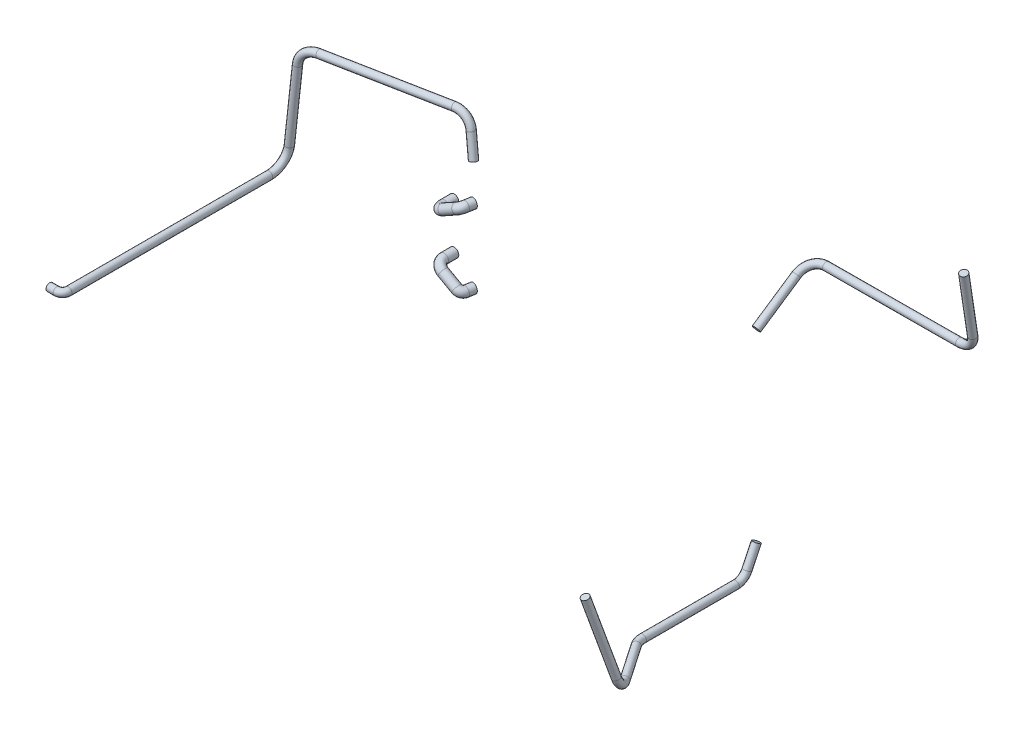
from build123d import *

# Parameters (mm, degrees)
PIPE_1_PROFILE_R = 5
PIPE_2_PROFILE_R = 5
PIPE_3_PROFILE_R = 4
PIPE_4_PROFILE_R = 4
PIPE_5_PROFILE_R = 4


with BuildPart() as part:
    # Pipe 1: sweep along a curve in space
    with BuildLine() as pipe_1_path:
        Line((300, 25, 337), (300, 25, 348))
        ThreePointArc((300, 25, 348), (302.304312645, 26.280173692, 354.363961031), (307.867415485, 29.370786381, 357))
        Line((307.867415485, 29.370786381, 357), (322.859191253, 37.699550696, 357))
        ThreePointArc((322.859191253, 37.699550696, 357), (326.042807371, 39.345053321, 355.669731643), (327.778744035, 40, 352.327535789))
        Line((327.778744035, 40, 352.327535789), (329, 40, 345))
    # Pipe 1 profile (on start of the path) → Pipe 1 (sweep)
    with BuildSketch(Plane(origin=(300, 25, 337), x_dir=(1, 0, 0), z_dir=(0, 0, 1))):
        Circle(PIPE_1_PROFILE_R)
    sweep(path=pipe_1_path.line)


with BuildPart() as body_2:
    # Pipe 2: sweep along a curve in space
    with BuildLine() as pipe_2_path:
        Line((300, -25, 337), (300, -25, 348))
        ThreePointArc((300, -25, 348), (302.304312645, -26.280173692, 354.363961031), (307.867415485, -29.370786381, 357))
        Line((307.867415485, -29.370786381, 357), (322.859191253, -37.699550696, 357))
        ThreePointArc((322.859191253, -37.699550696, 357), (326.042807371, -39.345053321, 355.669731643), (327.778744035, -40, 352.327535789))
        Line((327.778744035, -40, 352.327535789), (329, -40, 345))
    # Pipe 2 profile (on start of the path) → Pipe 2 (sweep)
    with BuildSketch(Plane(origin=(300, -25, 337), x_dir=(1, 0, 0), z_dir=(0, 0, 1))):
        Circle(PIPE_2_PROFILE_R)
    sweep(path=pipe_2_path.line)


with BuildPart() as body_3:
    # Pipe 3: sweep along a curve in space
    with BuildLine() as pipe_3_path:
        Line((138, 0, 614), (145.7, 0, 614))
        ThreePointArc((145.7, 0, 614), (150.154772721, 0, 612.154772721), (152, 0, 607.7))
        Line((152, 0, 607.7), (152, 0, 390))
        ThreePointArc((152, 0, 390), (152.641476778, 5.822635365, 375.857864376), (154.190138714, 19.879720632, 370))
        Line((154.190138714, 19.879720632, 370), (163.033931138, 100.154144177, 370))
        ThreePointArc((163.033931138, 100.154144177, 370), (169.489481869, 112.884075625, 369.021980518), (182.626708129, 118, 366.588379072))
        Line((182.626708129, 118, 366.588379072), (305.802558578, 118, 342.747891888))
        ThreePointArc((305.802558578, 118, 342.747891888), (316.93139492, 114.067577376, 341.291611449), (323.305769978, 104.042304539, 341.836538876))
        Line((323.305769978, 104.042304539, 341.836538876), (329, 80, 345))
    # Pipe 3 profile (on start of the path) → Pipe 3 (sweep)
    with BuildSketch(Plane(origin=(138, 0, 614), x_dir=(0, 0, 1), z_dir=(1, 0, 0))):
        Circle(PIPE_3_PROFILE_R)
    sweep(path=pipe_3_path.line)


with BuildPart() as body_4:
    # Pipe 4: sweep along a curve in space
    with BuildLine() as pipe_4_path:
        Line((690, -30, 584.864900164), (698.541892534, -113.710546837, 559.747116361))
        ThreePointArc((698.541892534, -113.710546837, 559.747116361), (697.192177504, -123.959853318, 553.175530204), (691.527218514, -128, 543.093803514))
        Line((691.527218514, -128, 543.093803514), (665.15121453, -128, 504.599072538))
        ThreePointArc((665.15121453, -128, 504.599072538), (662.805842003, -128, 499.750408824), (662, -128, 494.424910653))
        Line((662, -128, 494.424910653), (662, -128, 393.565312174))
        ThreePointArc((662, -128, 393.565312174), (661.927467944, -125.969102421, 386.217123967), (661.730485268, -120.453587506, 380.957279021))
        Line((661.730485268, -120.453587506, 380.957279021), (661, -100, 370))
    # Pipe 4 profile (on start of the path) → Pipe 4 (sweep)
    with BuildSketch(Plane(origin=(690, -30, 584.864900164), x_dir=(0, 0.2873963796583632, -0.9578117356554293), z_dir=(0.09727240776932868, -0.9532695961394353, -0.28603348713553706))):
        Circle(PIPE_4_PROFILE_R)
    sweep(path=pipe_4_path.line)


with BuildPart() as body_5:
    # Pipe 5: sweep along a curve in space
    with BuildLine() as pipe_5_path:
        Line((846, 225, 330), (841.158739606, 156.415477754, 315.476218818))
        ThreePointArc((841.158739606, 156.415477754, 315.476218818), (835.475581382, 144.742546105, 313.031602682), (823.180792044, 140, 312.094489932))
        Line((823.180792044, 140, 312.094489932), (679.661668733, 140, 312.900777142))
        ThreePointArc((679.661668733, 140, 312.900777142), (667.078855505, 137.040330318, 317.188580717), (661.746389215, 129.855568587, 327.455814764))
        Line((661.746389215, 129.855568587, 327.455814764), (661, 100, 370))
    # Pipe 5 profile (on start of the path) → Pipe 5 (sweep)
    with BuildSketch(Plane(origin=(846, 225, 330), x_dir=(0, 0.20717044190458347, -0.9783048645494203), z_dir=(-0.06889273999673895, -0.9759804832871486, -0.20667821999022007))):
        Circle(PIPE_5_PROFILE_R)
    sweep(path=pipe_5_path.line)


solid = Compound([part.part, body_2.part, body_3.part, body_4.part, body_5.part])
